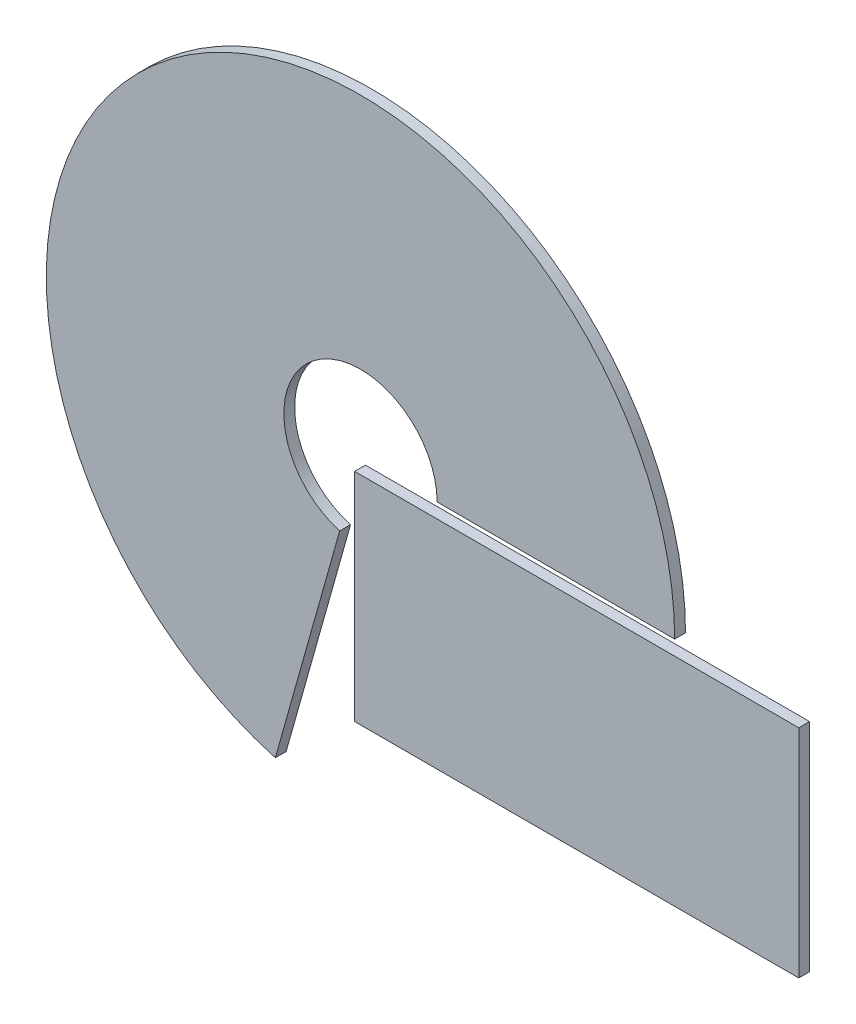
from build123d import *

# Parameters (mm, degrees)
BOSS_EXTRUDE1_DEPTH   = 2.54
SKETCH2_W             = 104.14
SKETCH2_H             = 50.8
BOSS_EXTRUDE1_2_DEPTH = 2.54


with BuildPart() as part:
    # Sketch2 → Boss-Extrude1 (new body)
    with BuildSketch(Plane.XY):
        with BuildLine():
            Line((17.971437451, 0), (73.66, 0))
            ThreePointArc((73.66, 0), (-44.47059818, 58.721048164), (-19.96371701, -70.903071888))
            Line((-19.96371701, -70.903071888), (-4.870712619, -17.298806972))
            ThreePointArc((-4.870712619, -17.298806972), (-10.849858453, 14.326658216), (17.971437451, 0))
        make_face()
    extrude(amount=BOSS_EXTRUDE1_DEPTH)


with BuildPart() as body_2:
    # Sketch2 → Boss-Extrude1 2 (new body)
    with BuildSketch(Plane.XY):
        with Locations((50.690821842, -28.856742093)):
            Rectangle(SKETCH2_W, SKETCH2_H)
    extrude(amount=BOSS_EXTRUDE1_2_DEPTH)


solid = Compound([part.part, body_2.part])
